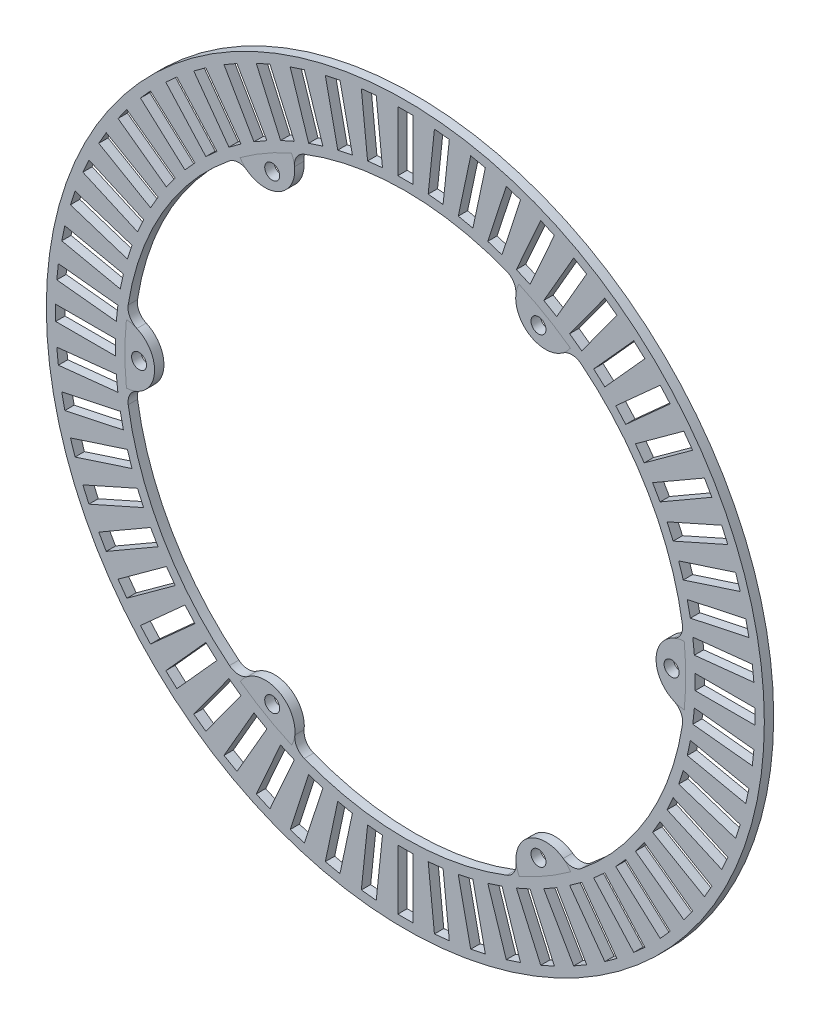
from build123d import *

# Parameters (mm, degrees)
SKETCH1_R                 = 60.96
SKETCH1_R_2               = 47.625
BOSS_EXTRUDE1_DEPTH       = 1.5875
SKETCH4_W                 = 2.54
SKETCH4_H                 = 10.16
CUT_EXTRUDE3_DEPTH        = 5.08
CIRPATTERN2_COUNT         = 60
BOSS_EXTRUDE2_START       = -1.5875
BOSS_EXTRUDE2_DEPTH       = 1.587512
FILLET1_R                 = 2.54
SKETCH9_R                 = 1.27
CUT_EXTRUDE6_DEPTH        = 87.22507419
CIRPATTERN12_COUNT        = 6
FILLET1_OF_CIRPATTERN12_R = 2.54


with BuildPart() as part:
    # Sketch1 → Boss-Extrude1 (new body)
    with BuildSketch(Plane.XY):
        Circle(SKETCH1_R)
        Circle(SKETCH1_R_2, mode=Mode.SUBTRACT)
    extrude(amount=BOSS_EXTRUDE1_DEPTH)

    # Sketch4 → Cut-Extrude3 (cut)
    with BuildSketch(Plane.XY.offset(1.5875)):
        with Locations((0, 54.2925)):
            Rectangle(SKETCH4_W, SKETCH4_H)
    cut_extrude3 = extrude(amount=-CUT_EXTRUDE3_DEPTH, mode=Mode.SUBTRACT)

    # CirPattern2: Cut-Extrude3 ×60 about axis
    cirpattern2_axis = Axis((0, 0, 0), (0, 0, 1))
    for i in range(1, CIRPATTERN2_COUNT):
        add(cut_extrude3.rotate(cirpattern2_axis, i * 360 / CIRPATTERN2_COUNT), mode=Mode.SUBTRACT)

    # Sketch8 → Boss-Extrude2 (add)
    with BuildSketch(Plane.XY.offset(1.5875).offset(BOSS_EXTRUDE2_START)):
        with BuildLine():
            ThreePointArc((47.354347194, 5.070150572), (42.574195627, 0.023787272), (47.359983268, -5.017231297))
            ThreePointArc((47.359983268, -5.017231297), (47.624992566, 0.02660928), (47.354347194, 5.070150572))
        make_face()
    boss_extrude2 = extrude(amount=BOSS_EXTRUDE2_DEPTH)

    # Fillet1
    fillet1_edges = [part.edges().sort_by_distance(p)[0] for p in [
        (47.354347194, 5.070150572, 0.79375),
        (47.359983268, -5.017231297, 0.79375),
    ]]
    fillet(fillet1_edges, radius=FILLET1_R)

    # Sketch9 → Cut-Extrude6 (cut, symmetric)
    with BuildSketch(Plane.XY.offset(1.587512)):
        with Locations((45.212, 0)):
            Circle(SKETCH9_R)
    cut_extrude6 = extrude(amount=CUT_EXTRUDE6_DEPTH, both=True, mode=Mode.SUBTRACT)

    # CirPattern12: Boss-Extrude2, Cut-Extrude6 ×6 about axis
    cirpattern12_axis = Axis((0, 0, 0), (0, 0, 1))
    add([boss_extrude2.rotate(cirpattern12_axis, i * 360 / CIRPATTERN12_COUNT) for i in range(1, CIRPATTERN12_COUNT)])
    add([cut_extrude6.rotate(cirpattern12_axis, i * 360 / CIRPATTERN12_COUNT) for i in range(1, CIRPATTERN12_COUNT)], mode=Mode.SUBTRACT)

    # Fillet1 of CirPattern12
    fillet1_of_cirpattern12_edges = [part.edges().sort_by_distance(p)[0] for p in [
        (19.2862944, 43.545142936, 0.79375),
        (28.025041394, 38.506332984, 0.79375),
        (-28.068052794, 38.474992363, 0.79375),
        (-19.334941874, 43.523564281, 0.79375),
        (-47.354347194, -5.070150572, 0.79375),
        (-47.359983268, 5.017231297, 0.79375),
        (-19.2862944, -43.545142936, 0.79375),
        (-28.025041394, -38.506332984, 0.79375),
        (28.068052794, -38.474992363, 0.79375),
        (19.334941874, -43.523564281, 0.79375),
    ]]
    fillet(fillet1_of_cirpattern12_edges, radius=FILLET1_OF_CIRPATTERN12_R)


solid = part.part
